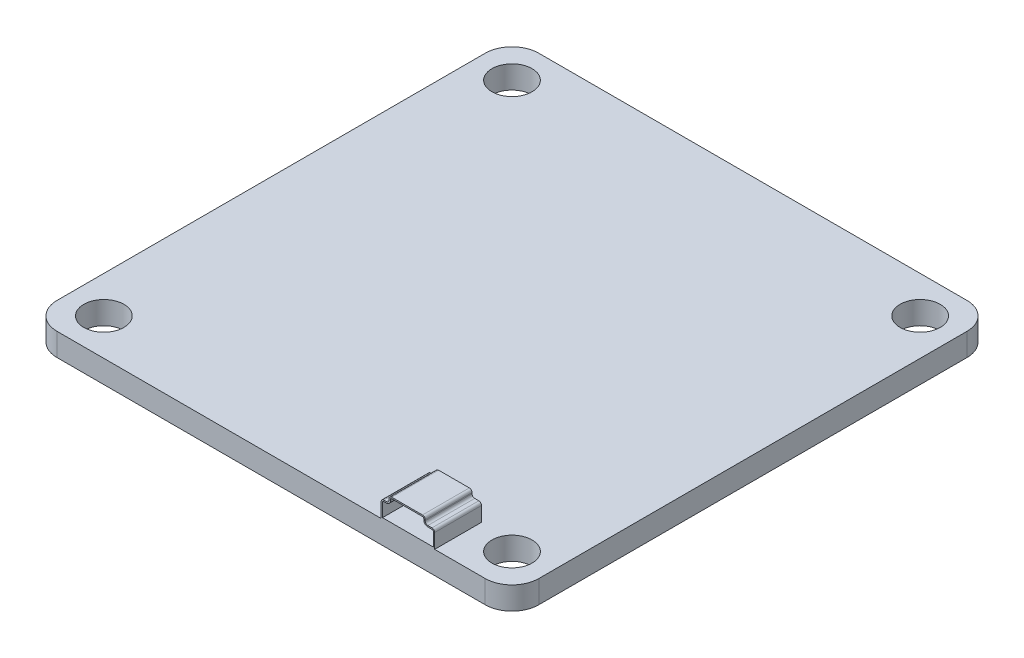
from build123d import *

# Parameters (mm, degrees)
SKETCH1_R           = 1.5
BOSS_EXTRUDE1_DEPTH = 1.7
BOSS_EXTRUDE2_DEPTH = 3
BOSS_EXTRUDE3_DEPTH = 0.5
CUT_EXTRUDE2_REACH  = 39.314
SKETCH4_R           = 0.230396576


with BuildPart() as part:
    # Sketch1 → Boss-Extrude1 (new body)
    with BuildSketch(Plane(origin=(0, 0, 0), x_dir=(1, 0, 0), z_dir=(0, 1, 0))):
        with BuildLine():
            Line((-16, 18), (16, 18))
            ThreePointArc((16, 18), (17.414213562, 17.414213562), (18, 16))
            Line((18, 16), (18, -16))
            ThreePointArc((18, -16), (17.414213562, -17.414213562), (16, -18))
            Line((16, -18), (-16, -18))
            ThreePointArc((-16, -18), (-17.414213562, -17.414213562), (-18, -16))
            Line((-18, -16), (-18, 16))
            ThreePointArc((-18, 16), (-17.414213562, 17.414213562), (-16, 18))
        make_face()
        with Locations(Location((-15.25, 15.25, 0), (0, 0, 270))):
            Circle(SKETCH1_R, mode=Mode.SUBTRACT)
        with Locations(Location((15.25, 15.25, 0), (0, 0, 270))):
            Circle(SKETCH1_R, mode=Mode.SUBTRACT)
        with Locations(Location((-15.25, -15.25, 0), (0, 0, 270))):
            Circle(SKETCH1_R, mode=Mode.SUBTRACT)
        with Locations(Location((15.25, -15.25, 0), (0, 0, 270))):
            Circle(SKETCH1_R, mode=Mode.SUBTRACT)
    extrude(amount=BOSS_EXTRUDE1_DEPTH)

    # Sketch2 → Boss-Extrude2 (add)
    with BuildSketch(Plane.XY.offset(18)):
        with BuildLine():
            Line((8.220977072, 1.7), (12.220977072, 1.7))
            Line((12.220977072, 1.7), (12.220977072, 2.791290101))
            ThreePointArc((12.220977072, 2.791290101), (12.162398428, 2.932711457), (12.020977072, 2.991290101))
            Line((12.020977072, 2.991290101), (11.710977072, 2.991290101))
            ThreePointArc((11.710977072, 2.991290101), (11.569555715, 3.049868744), (11.510977072, 3.191290101))
            Line((11.510977072, 3.191290101), (11.510977072, 3.271290101))
            ThreePointArc((11.510977072, 3.271290101), (11.452398428, 3.412711457), (11.310977072, 3.471290101))
            Line((11.310977072, 3.471290101), (9.010977072, 3.471290101))
            ThreePointArc((9.010977072, 3.471290101), (8.869555715, 3.412711457), (8.810977072, 3.271290101))
            Line((8.810977072, 3.271290101), (8.810977072, 3.191290101))
            ThreePointArc((8.810977072, 3.191290101), (8.752398428, 3.049868744), (8.610977072, 2.991290101))
            Line((8.610977072, 2.991290101), (8.420977072, 2.991290101))
            ThreePointArc((8.420977072, 2.991290101), (8.279555715, 2.932711457), (8.220977072, 2.791290101))
            Line((8.220977072, 2.791290101), (8.220977072, 1.7))
        make_face()
        with BuildLine():
            Line((8.320977072, 1.8), (12.120977072, 1.8))
            Line((12.120977072, 1.8), (12.120977072, 2.791290101))
            ThreePointArc((12.120977072, 2.791290101), (12.09168775, 2.862000779), (12.020977072, 2.891290101))
            Line((12.020977072, 2.891290101), (11.710977072, 2.891290101))
            ThreePointArc((11.710977072, 2.891290101), (11.498845037, 2.979158066), (11.410977072, 3.191290101))
            Line((11.410977072, 3.191290101), (11.410977072, 3.271290101))
            ThreePointArc((11.410977072, 3.271290101), (11.38168775, 3.342000779), (11.310977072, 3.371290101))
            Line((11.310977072, 3.371290101), (9.010977072, 3.371290101))
            ThreePointArc((9.010977072, 3.371290101), (8.940266393, 3.342000779), (8.910977072, 3.271290101))
            Line((8.910977072, 3.271290101), (8.910977072, 3.191290101))
            ThreePointArc((8.910977072, 3.191290101), (8.823109106, 2.979158066), (8.610977072, 2.891290101))
            Line((8.610977072, 2.891290101), (8.420977072, 2.891290101))
            ThreePointArc((8.420977072, 2.891290101), (8.350266393, 2.862000779), (8.320977072, 2.791290101))
            Line((8.320977072, 2.791290101), (8.320977072, 1.8))
        make_face(mode=Mode.SUBTRACT)
    extrude(amount=-BOSS_EXTRUDE2_DEPTH)

    # Sketch3 → Boss-Extrude3 (add)
    with BuildSketch(Plane(origin=(0, 0, 15), x_dir=(-1, 0, 0), z_dir=(0, 0, -1))):
        with BuildLine():
            Line((-8.220977072, 1.7), (-8.220977072, 2.791290101))
            ThreePointArc((-8.220977072, 2.791290101), (-8.279555715, 2.932711457), (-8.420977072, 2.991290101))
            Line((-8.420977072, 2.991290101), (-8.610977072, 2.991290101))
            ThreePointArc((-8.610977072, 2.991290101), (-8.752398428, 3.049868744), (-8.810977072, 3.191290101))
            Line((-8.810977072, 3.191290101), (-8.810977072, 3.271290101))
            ThreePointArc((-8.810977072, 3.271290101), (-8.869555715, 3.412711457), (-9.010977072, 3.471290101))
            Line((-9.010977072, 3.471290101), (-11.310977072, 3.471290101))
            ThreePointArc((-11.310977072, 3.471290101), (-11.452398428, 3.412711457), (-11.510977072, 3.271290101))
            Line((-11.510977072, 3.271290101), (-11.510977072, 3.191290101))
            ThreePointArc((-11.510977072, 3.191290101), (-11.569555715, 3.049868744), (-11.710977072, 2.991290101))
            Line((-11.710977072, 2.991290101), (-12.020977072, 2.991290101))
            ThreePointArc((-12.020977072, 2.991290101), (-12.162398428, 2.932711457), (-12.220977072, 2.791290101))
            Line((-12.220977072, 2.791290101), (-12.220977072, 1.7))
            Line((-12.220977072, 1.7), (-8.220977072, 1.7))
        make_face()
    extrude(amount=BOSS_EXTRUDE3_DEPTH)

    # Sketch4 → Cut-Extrude2 (cut, up to next)
    with BuildSketch(Plane(origin=(0, 0, 14.5), x_dir=(-1, 0, 0), z_dir=(0, 0, -1)), mode=Mode.PRIVATE) as cut_extrude2_sk1:
        with Locations((-11.120977072, 2.671290101)):
            Circle(SKETCH4_R)
    cut_extrude2_tool1 = extrude(cut_extrude2_sk1.sketch, amount=-CUT_EXTRUDE2_REACH, mode=Mode.PRIVATE) & part.part
    # Sketch4 → Cut-Extrude2 (cut, up to next)
    with BuildSketch(Plane(origin=(0, 0, 14.5), x_dir=(-1, 0, 0), z_dir=(0, 0, -1)), mode=Mode.PRIVATE) as cut_extrude2_sk2:
        with Locations((-10.420977072, 2.671290101)):
            Circle(SKETCH4_R)
    cut_extrude2_tool2 = extrude(cut_extrude2_sk2.sketch, amount=-CUT_EXTRUDE2_REACH, mode=Mode.PRIVATE) & part.part
    # Sketch4 → Cut-Extrude2 (cut, up to next)
    with BuildSketch(Plane(origin=(0, 0, 14.5), x_dir=(-1, 0, 0), z_dir=(0, 0, -1)), mode=Mode.PRIVATE) as cut_extrude2_sk3:
        with Locations((-9.720977072, 2.671290101)):
            Circle(SKETCH4_R)
    cut_extrude2_tool3 = extrude(cut_extrude2_sk3.sketch, amount=-CUT_EXTRUDE2_REACH, mode=Mode.PRIVATE) & part.part
    add(cut_extrude2_tool1.solids().sort_by_distance((11.120977, 2.67129, 14.5))[0], mode=Mode.SUBTRACT)
    add(cut_extrude2_tool2.solids().sort_by_distance((10.420977, 2.67129, 14.5))[0], mode=Mode.SUBTRACT)
    add(cut_extrude2_tool3.solids().sort_by_distance((9.720977, 2.67129, 14.5))[0], mode=Mode.SUBTRACT)


solid = part.part
